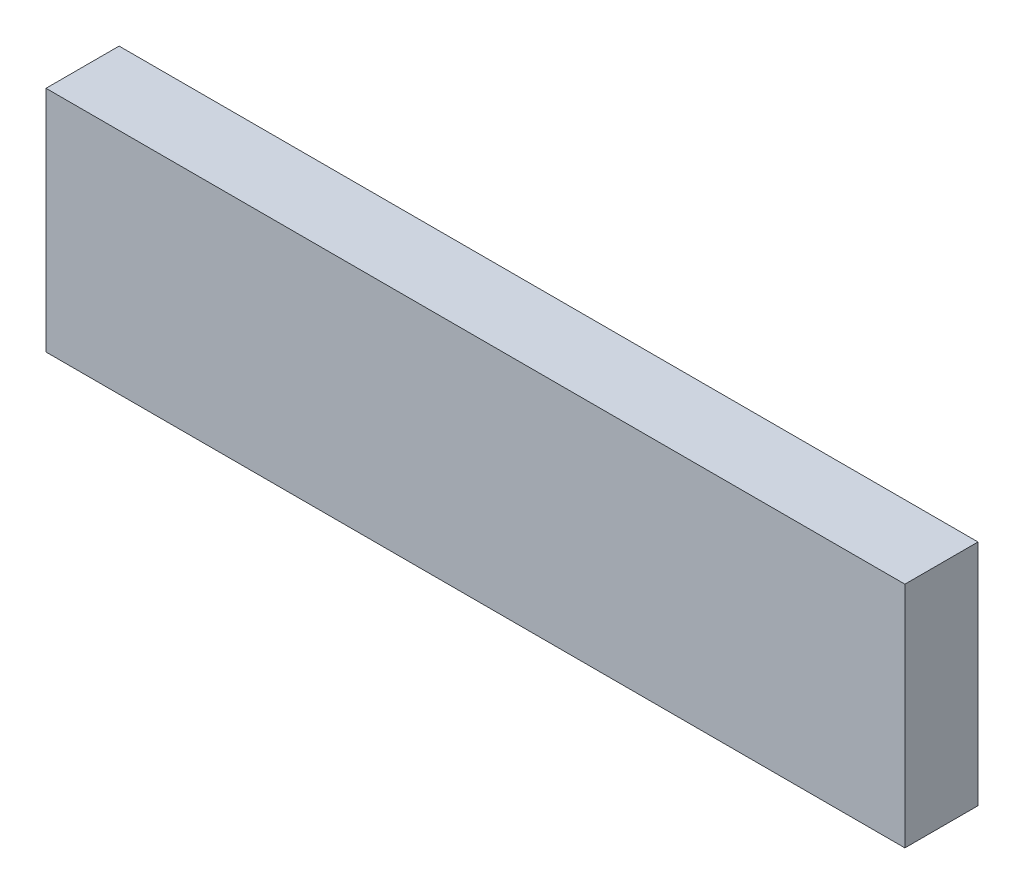
from build123d import *

# Parameters (mm, degrees)
ESBO_O1_W                = 94
ESBO_O1_H                = 25
RESSALTO_EXTRUS_O1_DEPTH = 8


with BuildPart() as part:
    # Esboço1 → Ressalto-extrusão1 (new body)
    with BuildSketch(Plane.XY):
        with Locations((0, -17.5)):
            Rectangle(ESBO_O1_W, ESBO_O1_H)
    extrude(amount=RESSALTO_EXTRUS_O1_DEPTH)


solid = part.part
